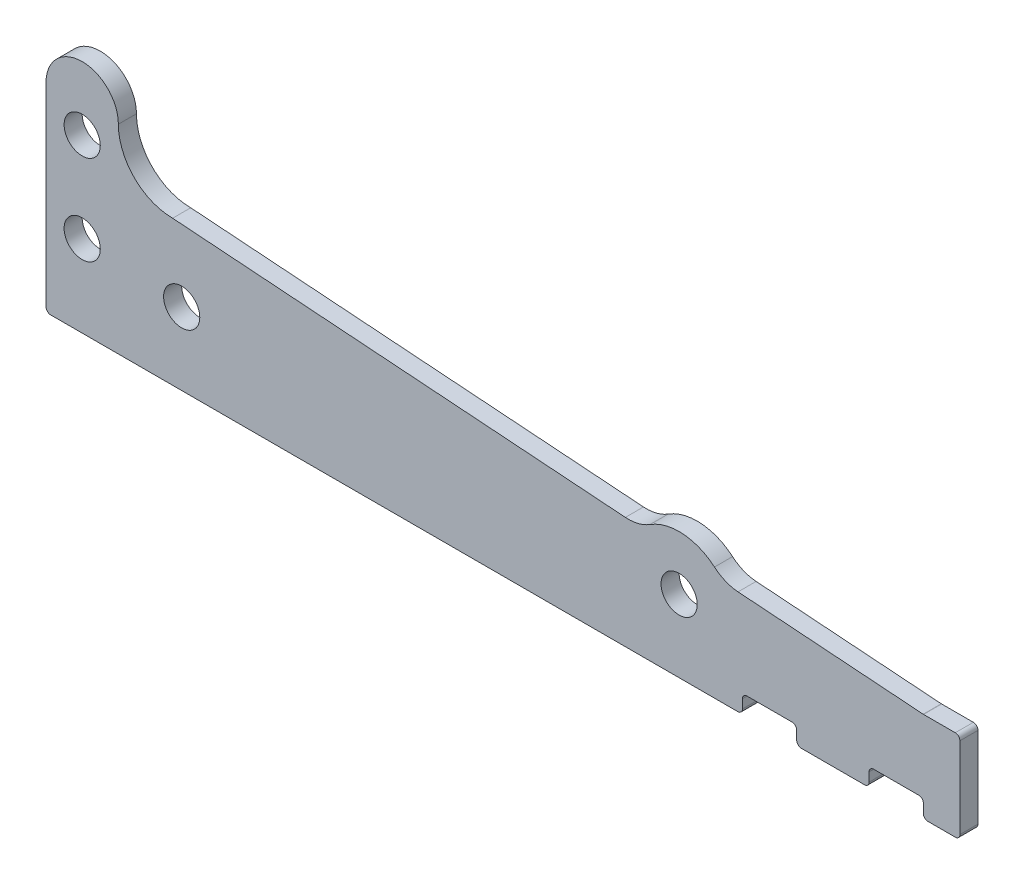
from build123d import *

# Parameters (mm, degrees)
SKETCH1_R           = 1.5875
BOSS_EXTRUDE1_DEPTH = 1.5875
FILLET1_R           = 0.4064
FILLET2_R           = 3.571875


with BuildPart() as part:
    # Sketch1 → Boss-Extrude1 (new body)
    with BuildSketch(Plane.XY):
        with BuildLine():
            Line((0, -1.5875), (61.114741118, -1.5875))
            Line((61.114741118, -1.5875), (61.114741118, 0))
            Line((61.114741118, 0), (65.877241118, 0))
            Line((65.877241118, 0), (65.877241118, -1.5875))
            Line((65.877241118, -1.5875), (72.227241118, -1.5875))
            Line((72.227241118, -1.5875), (72.227241118, 0))
            Line((72.227241118, 0), (76.989741118, 0))
            Line((76.989741118, 0), (76.989741118, -1.5875))
            Line((76.989741118, -1.5875), (80.196975496, -1.5875))
            Line((80.196975496, -1.5875), (80.196975496, 6.35))
            Line((80.196975496, 6.35), (76.989741118, 6.35))
            Line((76.989741118, 6.35), (59.365392502, 7.624126828))
            ThreePointArc((59.365392502, 7.624126828), (55.901892976, 9.512603306), (52.202778478, 8.141937664))
            Line((52.202778478, 8.141937664), (11.1125, 11.1125))
            ThreePointArc((11.1125, 11.1125), (7.744903955, 12.507403955), (6.35, 15.875))
            ThreePointArc((6.35, 15.875), (3.175, 19.05), (0, 15.875))
            Line((0, 15.875), (0, -1.5875))
        make_face()
        with Locations((3.175, 5.588)):
            Circle(SKETCH1_R, mode=Mode.SUBTRACT)
        with Locations((3.175, 13.462)):
            Circle(SKETCH1_R, mode=Mode.SUBTRACT)
        with Locations((11.90625, 4.7625)):
            Circle(SKETCH1_R, mode=Mode.SUBTRACT)
        with Locations((55.558491118, 4.7625)):
            Circle(SKETCH1_R, mode=Mode.SUBTRACT)
    extrude(amount=BOSS_EXTRUDE1_DEPTH)

    # Fillet1
    fillet1_edges = [part.edges().sort_by_distance(p)[0] for p in [
        (76.989741118, 6.35, 0.79375),
        (80.196975496, 6.35, 0.79375),
        (80.196975496, -1.5875, 0.79375),
        (76.989741118, -1.5875, 0.79375),
        (76.989741118, 0, 0.79375),
        (72.227241118, 0, 0.79375),
        (72.227241118, -1.5875, 0.79375),
        (65.877241118, -1.5875, 0.79375),
        (65.877241118, 0, 0.79375),
        (61.114741118, 0, 0.79375),
        (61.114741118, -1.5875, 0.79375),
        (0, -1.5875, 0.79375),
    ]]
    fillet(fillet1_edges, radius=FILLET1_R)

    # Fillet2
    fillet2_edges = [part.edges().sort_by_distance(p)[0] for p in [
        (52.202778478, 8.141937664, 0.79375),
        (59.365392502, 7.624126828, 0.79375),
    ]]
    fillet(fillet2_edges, radius=FILLET2_R)


solid = part.part
